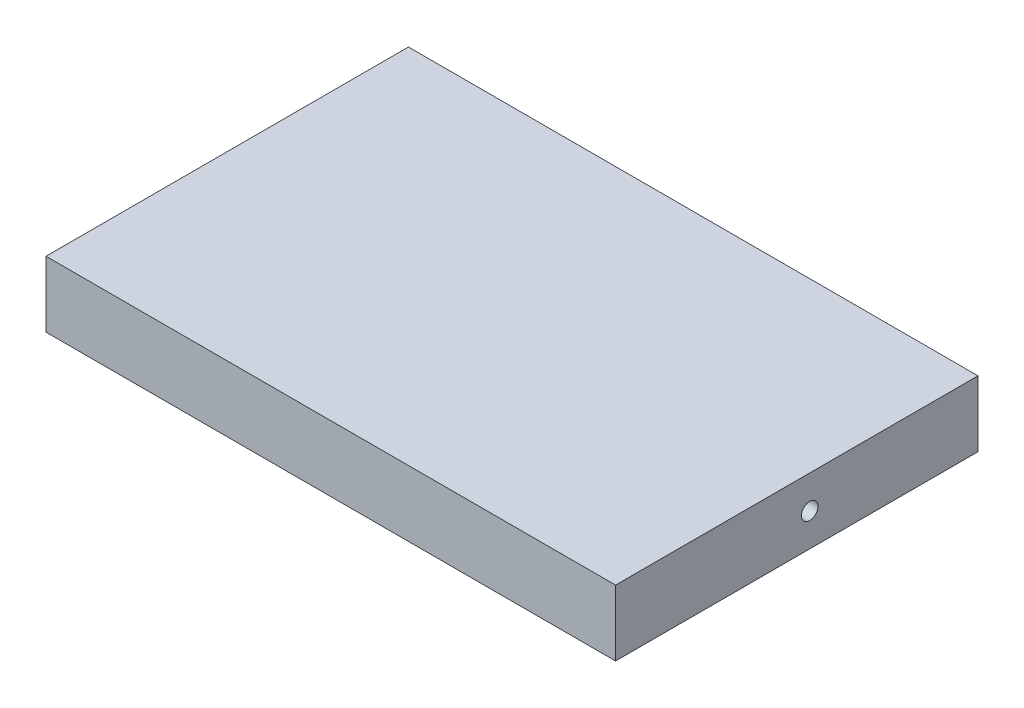
from build123d import *

# Parameters (mm, degrees)
SKETCH1_W           = 220
SKETCH1_H           = 140
BOSS_EXTRUDE1_DEPTH = 25.4
SKETCH3_R           = 3.2
CUT_EXTRUDE1_DEPTH  = 20
CUT_EXTRUDE2_START  = -20
SKETCH2_R           = 3.2
CUT_EXTRUDE2_DEPTH  = 20


with BuildPart() as part:
    # Sketch1 → Boss-Extrude1 (new body)
    with BuildSketch(Plane(origin=(0, 0, 0), x_dir=(1, 0, 0), z_dir=(0, 1, 0))):
        Rectangle(SKETCH1_W, SKETCH1_H)
    extrude(amount=BOSS_EXTRUDE1_DEPTH)

    # Sketch3 → Cut-Extrude1 (cut)
    with BuildSketch(Plane.ZY.offset(110)):
        with Locations((-5, 12.7)):
            Circle(SKETCH3_R)
    extrude(amount=-CUT_EXTRUDE1_DEPTH, mode=Mode.SUBTRACT)

    # Sketch2 → Cut-Extrude2 (cut)
    with BuildSketch(Plane(origin=(110, 0, 0), x_dir=(0, 0, -1), z_dir=(1, 0, 0)).offset(CUT_EXTRUDE2_START)):
        with Locations(Location((5, 12.7, 0), (0, 0, 180))):
            Circle(SKETCH2_R)
    extrude(amount=CUT_EXTRUDE2_DEPTH, mode=Mode.SUBTRACT)


solid = part.part
